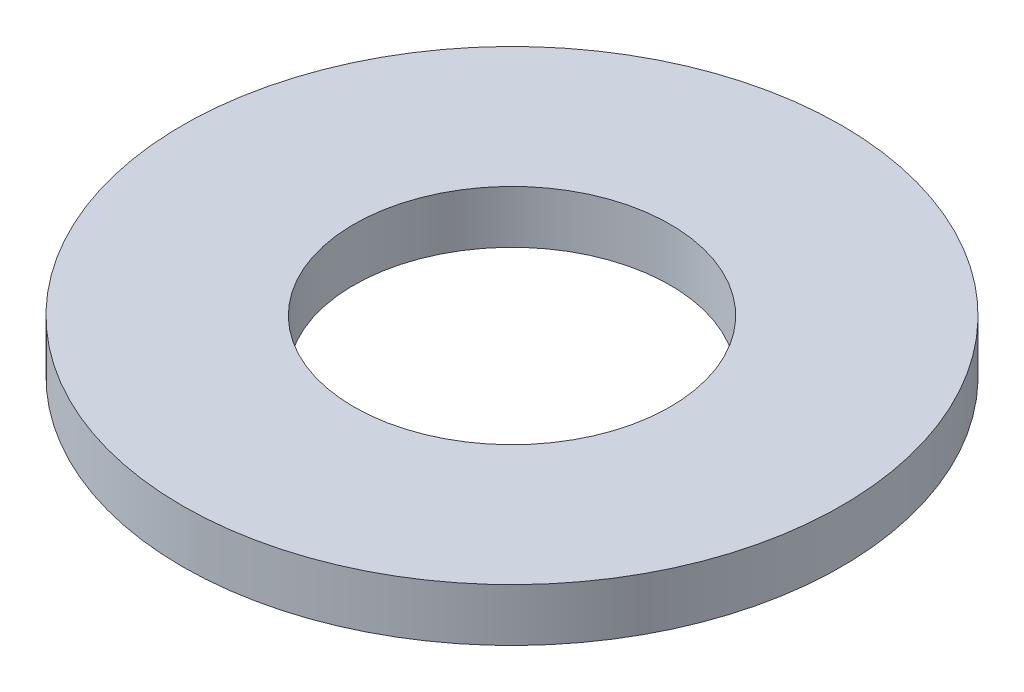
from build123d import *

# Parameters (mm, degrees)
SKETCH1_R          = 6.25
SKETCH1_R_2        = 3
BASE_EXTRUDE_DEPTH = 0.5


with BuildPart() as part:
    # Sketch1 → Base-Extrude (new, symmetric)
    with BuildSketch(Plane(origin=(0, 0, 0), x_dir=(1, 0, 0), z_dir=(0, 1, 0))):
        with Locations(Location((0, 0, 0), (0, 0, 270))):
            Circle(SKETCH1_R)
        with Locations(Location((0, 0, 0), (0, 0, 270))):
            Circle(SKETCH1_R_2, mode=Mode.SUBTRACT)
    extrude(amount=BASE_EXTRUDE_DEPTH, both=True)


solid = part.part
